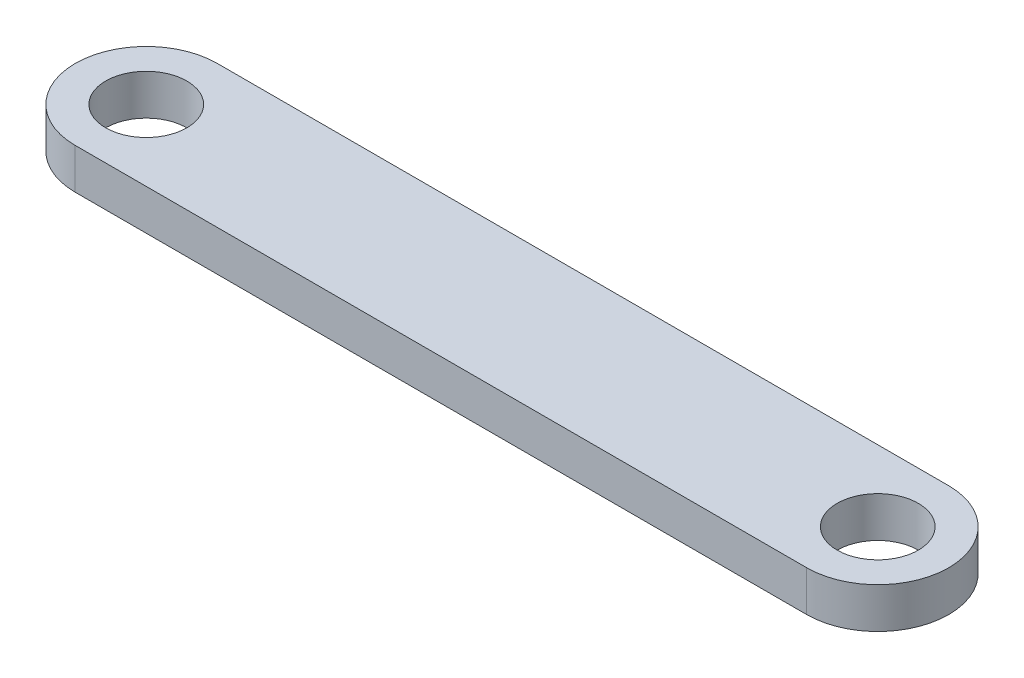
from build123d import *

# Parameters (mm, degrees)
SKETCH2_R           = 2
BOSS_EXTRUDE1_DEPTH = 2


with BuildPart() as part:
    # Sketch2 → Boss-Extrude1 (new body)
    with BuildSketch(Plane(origin=(0, 0, 0), x_dir=(1, 0, 0), z_dir=(0, 1, 0))):
        with BuildLine():
            Line((-26.66067196, 9.961352868), (9.38932804, 9.961352868))
            ThreePointArc((9.38932804, 9.961352868), (12.88932804, 6.461352868), (9.38932804, 2.961352868))
            Line((9.38932804, 2.961352868), (-26.66067196, 2.961352868))
            ThreePointArc((-26.66067196, 2.961352868), (-30.16067196, 6.461352868), (-26.66067196, 9.961352868))
        make_face()
        with Locations(Location((-26.66067196, 6.461352868, 0), (0, 0, 270))):
            Circle(SKETCH2_R, mode=Mode.SUBTRACT)
        with Locations(Location((9.38932804, 6.461352868, 0), (0, 0, 270))):
            Circle(SKETCH2_R, mode=Mode.SUBTRACT)
    extrude(amount=BOSS_EXTRUDE1_DEPTH)


solid = part.part
